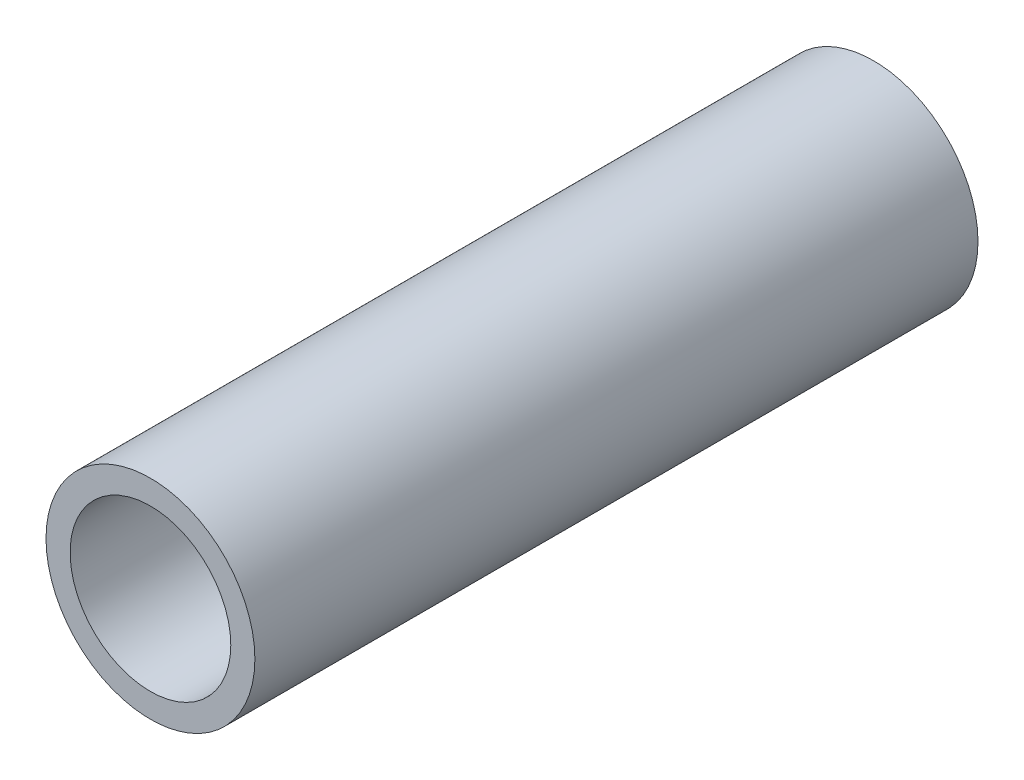
from build123d import *

# Parameters (mm, degrees)
SKETCH1_R           = 16.51
SKETCH1_R_2         = 12.7
BOSS_EXTRUDE1_DEPTH = 114.3


with BuildPart() as part:
    # Sketch1 → Boss-Extrude1 (new body)
    with BuildSketch(Plane.XY):
        Circle(SKETCH1_R)
        Circle(SKETCH1_R_2, mode=Mode.SUBTRACT)
    extrude(amount=BOSS_EXTRUDE1_DEPTH)


solid = part.part
